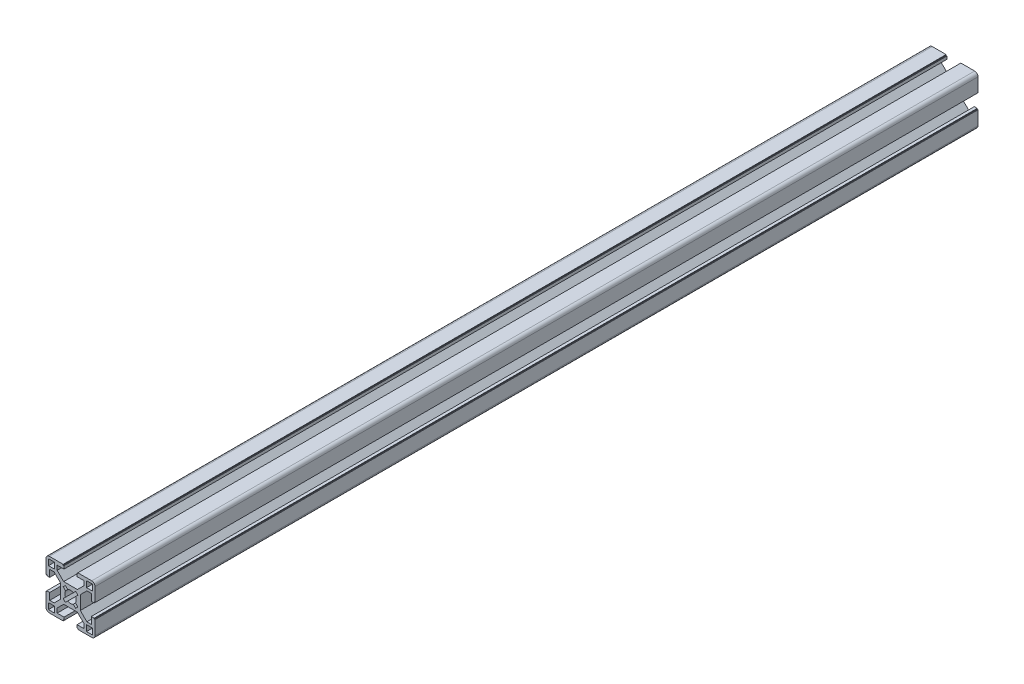
from build123d import *

# Parameters (mm, degrees)
SKETCH3_W           = 3.68
SKETCH3_H           = 3.68
BOSS_EXTRUDE1_DEPTH = 1219.2
SKETCH4_W           = 30
SKETCH4_H           = 1898.4
CUT_EXTRUDE1_DEPTH  = 1220.661280848


with BuildPart() as part:
    # Sketch3 → Boss-Extrude1 (new, symmetric)
    with BuildSketch(Plane.XY):
        with BuildLine():
            Line((-4.203948776, 6), (0, 6))
            Line((0, 6), (4.203948776, 6))
            Line((4.203948776, 6), (8.2, 9.996051224))
            Line((8.2, 9.996051224), (8.2, 12.71))
            Line((8.2, 12.71), (4, 12.71))
            Line((4, 12.71), (4, 14.5))
            Line((4, 14.5), (4.5, 14.5))
            Line((4.5, 14.5), (4.5, 15))
            Line((4.5, 15), (12.968, 15))
            ThreePointArc((12.968, 15), (14.404840979, 14.404840979), (15, 12.968))
            Line((15, 12.968), (15, 4.5))
            Line((15, 4.5), (14.5, 4.5))
            Line((14.5, 4.5), (14.5, 4))
            Line((14.5, 4), (12.71, 4))
            Line((12.71, 4), (12.71, 8.2))
            Line((12.71, 8.2), (9.996051224, 8.2))
            Line((9.996051224, 8.2), (6, 4.203948776))
            Line((6, 4.203948776), (6, 0))
            Line((6, 0), (6, -4.203948776))
            Line((6, -4.203948776), (9.996051224, -8.2))
            Line((9.996051224, -8.2), (12.71, -8.2))
            Line((12.71, -8.2), (12.71, -4))
            Line((12.71, -4), (14.5, -4))
            Line((14.5, -4), (14.5, -4.5))
            Line((14.5, -4.5), (15, -4.5))
            Line((15, -4.5), (15, -12.968))
            ThreePointArc((15, -12.968), (14.404840979, -14.404840979), (12.968, -15))
            Line((12.968, -15), (4.5, -15))
            Line((4.5, -15), (4.5, -14.5))
            Line((4.5, -14.5), (4, -14.5))
            Line((4, -14.5), (4, -12.71))
            Line((4, -12.71), (8.2, -12.71))
            Line((8.2, -12.71), (8.2, -9.996051224))
            Line((8.2, -9.996051224), (4.203948776, -6))
            Line((4.203948776, -6), (0, -6))
            Line((0, -6), (-4.203948776, -6))
            Line((-4.203948776, -6), (-8.2, -9.996051224))
            Line((-8.2, -9.996051224), (-8.2, -12.71))
            Line((-8.2, -12.71), (-4, -12.71))
            Line((-4, -12.71), (-4, -14.5))
            Line((-4, -14.5), (-4.5, -14.5))
            Line((-4.5, -14.5), (-4.5, -15))
            Line((-4.5, -15), (-12.968, -15))
            ThreePointArc((-12.968, -15), (-14.404840979, -14.404840979), (-15, -12.968))
            Line((-15, -12.968), (-15, -4.5))
            Line((-15, -4.5), (-14.5, -4.5))
            Line((-14.5, -4.5), (-14.5, -4))
            Line((-14.5, -4), (-12.71, -4))
            Line((-12.71, -4), (-12.71, -8.2))
            Line((-12.71, -8.2), (-9.996051224, -8.2))
            Line((-9.996051224, -8.2), (-6, -4.203948776))
            Line((-6, -4.203948776), (-6, 0))
            Line((-6, 0), (-6, 4.203948776))
            Line((-6, 4.203948776), (-9.996051224, 8.2))
            Line((-9.996051224, 8.2), (-12.71, 8.2))
            Line((-12.71, 8.2), (-12.71, 4))
            Line((-12.71, 4), (-14.5, 4))
            Line((-14.5, 4), (-14.5, 4.5))
            Line((-14.5, 4.5), (-15, 4.5))
            Line((-15, 4.5), (-15, 12.968))
            ThreePointArc((-15, 12.968), (-14.404840979, 14.404840979), (-12.968, 15))
            Line((-12.968, 15), (-4.5, 15))
            Line((-4.5, 15), (-4.5, 14.5))
            Line((-4.5, 14.5), (-4, 14.5))
            Line((-4, 14.5), (-4, 12.71))
            Line((-4, 12.71), (-8.2, 12.71))
            Line((-8.2, 12.71), (-8.2, 9.996051224))
            Line((-8.2, 9.996051224), (-4.203948776, 6))
        make_face()
        with Locations((-11.63, 11.63)):
            Rectangle(SKETCH3_W, SKETCH3_H, mode=Mode.SUBTRACT)
        with BuildLine():
            Line((-3.143089642, 4.493663594), (-1.705676589, 3.056250541))
            ThreePointArc((-1.705676589, 3.056250541), (0, 3.5), (1.705676589, 3.056250541))
            Line((1.705676589, 3.056250541), (3.143089642, 4.493663594))
            Line((3.143089642, 4.493663594), (4.493663594, 3.143089642))
            Line((4.493663594, 3.143089642), (3.056250541, 1.705676589))
            ThreePointArc((3.056250541, 1.705676589), (3.5, 0), (3.056250541, -1.705676589))
            Line((3.056250541, -1.705676589), (4.493663594, -3.143089642))
            Line((4.493663594, -3.143089642), (3.143089642, -4.493663594))
            Line((3.143089642, -4.493663594), (1.705676589, -3.056250541))
            ThreePointArc((1.705676589, -3.056250541), (0, -3.5), (-1.705676589, -3.056250541))
            Line((-1.705676589, -3.056250541), (-3.143089642, -4.493663594))
            Line((-3.143089642, -4.493663594), (-4.493663594, -3.143089642))
            Line((-4.493663594, -3.143089642), (-3.056250541, -1.705676589))
            ThreePointArc((-3.056250541, -1.705676589), (-3.5, 0), (-3.056250541, 1.705676589))
            Line((-3.056250541, 1.705676589), (-4.493663594, 3.143089642))
            Line((-4.493663594, 3.143089642), (-3.143089642, 4.493663594))
        make_face(mode=Mode.SUBTRACT)
        with Locations((11.63, 11.63)):
            Rectangle(SKETCH3_W, SKETCH3_H, mode=Mode.SUBTRACT)
        with Locations((11.63, -11.63)):
            Rectangle(SKETCH3_W, SKETCH3_H, mode=Mode.SUBTRACT)
        with Locations((-11.63, -11.63)):
            Rectangle(SKETCH3_W, SKETCH3_H, mode=Mode.SUBTRACT)
    extrude(amount=BOSS_EXTRUDE1_DEPTH, both=True)

    # Sketch4 → Cut-Extrude1 (cut, through all)
    with BuildSketch(Plane(origin=(0, 15, 0), x_dir=(1, 0, 0), z_dir=(0, 1, 0))):
        with Locations((0, 270)):
            Rectangle(SKETCH4_W, SKETCH4_H)
    extrude(amount=-CUT_EXTRUDE1_DEPTH, mode=Mode.SUBTRACT)


solid = part.part
